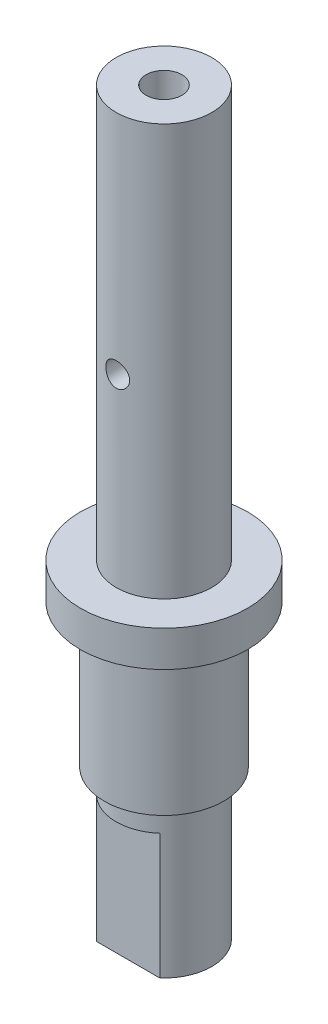
from build123d import *
from build123d.topology import SkipClean

# Parameters (mm, degrees)
SKETCH1_R                    = 4
COUPLER_SECTION_DEPTH        = 12.5
SKETCH3_R                    = 5
BEARING_SECTION_DEPTH        = 12
SKETCH4_R                    = 7
BEARING_STOP_DEPTH           = 3
SKETCH5_R                    = 4
SMALL_SEAL_SECTION_DEPTH     = 12.3
SET_SCREW_FLAT_SECTION_DEPTH = 10.5
SKETCH7_R                    = 4
IMPELLER_SECTION_DEPTH       = 22.163925
SKETCH8_R                    = 1.5
CUT_EXTRUDE1_DEPTH           = 8
CUT_EXTRUDE2_DEPTH           = 23
CUT_EXTRUDE2_DEPTH_BACK      = 23
SKETCH9_R                    = 1


with BuildPart() as part:
    # Sketch1 → coupler section (new body)
    with BuildSketch(Plane(origin=(0, 0, 0), x_dir=(1, 0, 0), z_dir=(0, 1, 0))):
        with Locations(Location((0, 0, 0), (0, 0, 270))):
            Circle(SKETCH1_R)
    extrude(amount=COUPLER_SECTION_DEPTH)

    # Sketch3 → bearing section (add)
    with BuildSketch(Plane(origin=(0, 12.5, 0), x_dir=(1, 0, 0), z_dir=(0, 1, 0))):
        with Locations(Location((0, 0, 0), (0, 0, 270))):
            Circle(SKETCH3_R)
    extrude(amount=BEARING_SECTION_DEPTH)

    # Sketch4 → bearing stop (add)
    with BuildSketch(Plane(origin=(0, 24.5, 0), x_dir=(1, 0, 0), z_dir=(0, 1, 0))):
        with Locations(Location((0, 0, 0), (0, 0, 270))):
            Circle(SKETCH4_R)
    extrude(amount=BEARING_STOP_DEPTH)

    # Sketch5 → small seal section (add)
    with BuildSketch(Plane(origin=(0, 27.5, 0), x_dir=(1, 0, 0), z_dir=(0, 1, 0))):
        with Locations(Location((0, 0, 0), (0, 0, 270))):
            Circle(SKETCH5_R)
    extrude(amount=SMALL_SEAL_SECTION_DEPTH)

    # Sketch6 → set screw flat section (cut)
    with BuildSketch(Plane.XZ):
        with BuildLine():
            Line((-2.645751311, 3), (2.645751311, 3))
            ThreePointArc((2.645751311, 3), (0, 4), (-2.645751311, 3))
        make_face()
    extrude(amount=-SET_SCREW_FLAT_SECTION_DEPTH, mode=Mode.SUBTRACT)

    # Sketch7 → impeller section (add)
    with BuildSketch(Plane(origin=(0, 39.8, 0), x_dir=(1, 0, 0), z_dir=(0, 1, 0))):
        with Locations(Location((0, 0, 0), (0, 0, 311.409622109))):
            Circle(SKETCH7_R)
    extrude(amount=IMPELLER_SECTION_DEPTH)

    # Sketch8 → Cut-Extrude1 (cut)
    with BuildSketch(Plane(origin=(0, 61.963925, 0), x_dir=(1, 0, 0), z_dir=(0, 1, 0))):
        with Locations(Location((0, 0, 0), (0, 0, 270))):
            Circle(SKETCH8_R)
    extrude(amount=-CUT_EXTRUDE1_DEPTH, mode=Mode.SUBTRACT)

    # Sketch9 → Cut-Extrude2 (cut, two sides: drawn at the far end of the back side and taken through both)
    with SkipClean():  # the faces are left unmerged after this step: merging them gives an invalid solid
        with BuildSketch(Plane.XY.offset(-CUT_EXTRUDE2_DEPTH_BACK)):
            with Locations(Location((0, 42.963925, 0), (0, 0, 89.999999996))):
                Circle(SKETCH9_R)
        extrude(amount=CUT_EXTRUDE2_DEPTH + CUT_EXTRUDE2_DEPTH_BACK, mode=Mode.SUBTRACT)


solid = part.part
